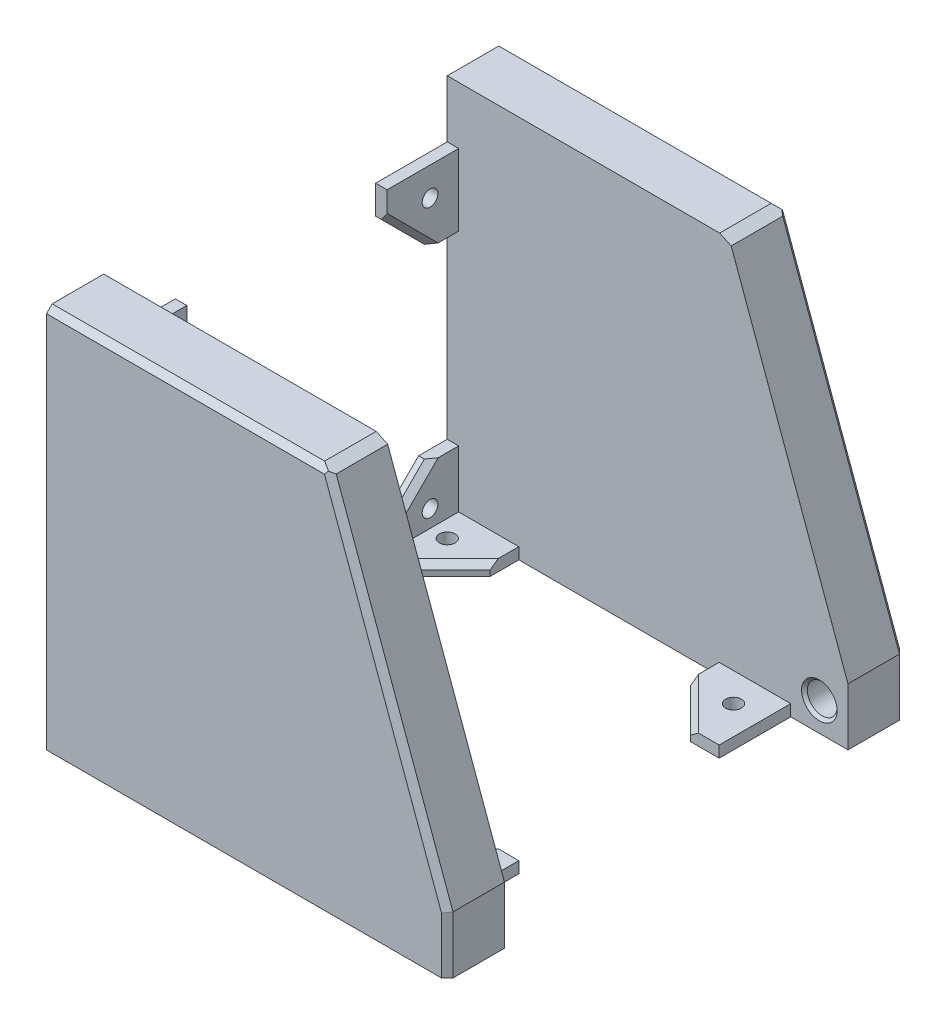
from build123d import *

# Parameters (mm, degrees)
BOSS_EXTRUDE1_DEPTH     = 80
CUT_EXTRUDE3_REACH      = 125.053
SKETCH2_W               = 60
SKETCH2_H               = 56.984631039
SKETCH2_H_2             = 10
CUT_EXTRUDE4_DEPTH      = 65
CUT_EXTRUDE4_DEPTH_BACK = 5
SKETCH4_R               = 2.6
SKETCH6_W               = 12.5
SKETCH6_H               = 12.5
BOSS_EXTRUDE2_DEPTH     = 2
CHAMFER1_SIZE           = 7.5
CHAMFER2_SIZE           = 7.5
SKETCH7_R               = 1.375
CUT_EXTRUDE5_DEPTH      = 2
CHAMFER3_SIZE           = 1
CHAMFER4_SIZE           = 1
CHAMFER5_SIZE           = 1
CHAMFER6_SIZE           = 1
CHAMFER7_SIZE           = 0.5
CHAMFER8_SIZE           = 0.5
CHAMFER9_SIZE           = 1
CHAMFER9_SIZE2          = 1.673157185
CHAMFER10_SIZE          = 1
CHAMFER10_SIZE2         = 1.673157185
SKETCH9_W               = 2
SKETCH9_H               = 12.5
BOSS_EXTRUDE3_DEPTH     = 10
CHAMFER11_SIZE          = 7.5
CHAMFER12_SIZE          = 7.5
CHAMFER13_SIZE          = 1
CHAMFER14_SIZE          = 1
SKETCH11_W              = 2
SKETCH11_H              = 12.5
BOSS_EXTRUDE4_DEPTH     = 12.5
SKETCH12_W              = 2
SKETCH12_H              = 12.5
BOSS_EXTRUDE5_DEPTH     = 12.5
CHAMFER15_SIZE          = 7.5
CHAMFER16_SIZE          = 7.5
CHAMFER17_SIZE          = 1
CHAMFER18_SIZE          = 1
SKETCH10_R              = 1.375
CUT_EXTRUDE6_DEPTH      = 2


with BuildPart() as part:
    # Sketch1 → Boss-Extrude1 (new body)
    with BuildSketch(Plane.XY):
        Polygon((-64.999999996, -5), (5, -5), (5, 5), (-15.740709509, 61.984631039), (-64.999999996, 61.984631039), align=None)
    extrude(amount=BOSS_EXTRUDE1_DEPTH)

    # Cut-Extrude3: up to this face of the body (flat: up to its plane)
    cut_extrude3_end = Plane(part.part.faces().sort_by_distance((-64.999999996, 28.49231552, 40))[0])
    # Sketch2 → Cut-Extrude3 (cut, up to the picked face)
    with BuildSketch(Plane(origin=(5, 0, 0), x_dir=(0, 0, -1), z_dir=(1, 0, 0)), mode=Mode.PRIVATE) as cut_extrude3_sk1:
        with Locations((-40, 33.49231552)):
            Rectangle(SKETCH2_W, SKETCH2_H)
    cut_extrude3_tool1 = split(extrude(cut_extrude3_sk1.sketch, amount=-CUT_EXTRUDE3_REACH, mode=Mode.PRIVATE), bisect_by=cut_extrude3_end, keep=Keep.BOTH, mode=Mode.PRIVATE)
    # Sketch2 → Cut-Extrude3 (cut, up to the picked face)
    with BuildSketch(Plane(origin=(5, 0, 0), x_dir=(0, 0, -1), z_dir=(1, 0, 0)), mode=Mode.PRIVATE) as cut_extrude3_sk2:
        with Locations((-40, 0)):
            Rectangle(SKETCH2_W, SKETCH2_H_2)
    cut_extrude3_tool2 = split(extrude(cut_extrude3_sk2.sketch, amount=-CUT_EXTRUDE3_REACH, mode=Mode.PRIVATE), bisect_by=cut_extrude3_end, keep=Keep.BOTH, mode=Mode.PRIVATE)
    add(cut_extrude3_tool1.solids().sort_by(Axis((5, 33.492316, 40), (-1, 0, 0)))[0], mode=Mode.SUBTRACT)
    add(cut_extrude3_tool2.solids().sort_by(Axis((5, 0, 40), (-1, 0, 0)))[0], mode=Mode.SUBTRACT)


with BuildPart() as cut_extrude3_piece_1:
    # of the separate pieces the step leaves, piece 1, a body of its own (cut_extrude3_pieces)
    add(part.part.solids().sort_by_distance((-15.740709509, 61.984631039, 0))[0])


with BuildPart() as cut_extrude3_piece_2:
    # of the separate pieces the step leaves, piece 2, a body of its own (cut_extrude3_pieces)
    add(part.part.solids().sort_by_distance((-15.740709509, 61.984631039, 70))[0])


with BuildPart() as cut_extrude4_tool:
    # Sketch4 → Cut-Extrude4 (new, two sides: drawn at the far end of the back side and taken through both)
    with BuildSketch(Plane.XY.offset(10).offset(-CUT_EXTRUDE4_DEPTH_BACK)):
        with Locations(Location((0, 0, 0), (0, 0, 180))):
            Circle(SKETCH4_R)
    extrude(amount=CUT_EXTRUDE4_DEPTH + CUT_EXTRUDE4_DEPTH_BACK)


with BuildPart() as cut_extrude3_piece_1_1:
    add(cut_extrude3_piece_1.part)

    # Cut-Extrude4: cut by cut_extrude4_tool
    add(cut_extrude4_tool.part, mode=Mode.SUBTRACT)



with BuildPart() as cut_extrude3_piece_2_1:
    add(cut_extrude3_piece_2.part)

    # Cut-Extrude4: cut by cut_extrude4_tool
    add(cut_extrude4_tool.part, mode=Mode.SUBTRACT)


with BuildPart() as cut_extrude3_piece_1_2:
    add(cut_extrude3_piece_1_1.part)

    add(cut_extrude3_piece_2_1.part)  # Boss-Extrude2 merges Cut-Extrude3 piece 2
    # Sketch6 → Boss-Extrude2 (add)
    with BuildSketch(Plane.XZ.offset(5)):
        with Locations((-11.249999996, 63.75)):
            Rectangle(SKETCH6_W, SKETCH6_H)
        with Locations((-58.749999996, 63.75)):
            Rectangle(SKETCH6_W, SKETCH6_H)
        with Locations((-58.749999996, 16.25)):
            Rectangle(SKETCH6_W, SKETCH6_H)
        with Locations((-11.249999996, 16.25)):
            Rectangle(SKETCH6_W, SKETCH6_H)
    extrude(amount=-BOSS_EXTRUDE2_DEPTH)

    # Chamfer1
    chamfer1_edges = [cut_extrude3_piece_1_2.edges().sort_by_distance(p)[0] for p in [
        (-52.499999996, -4, 22.5),
        (-17.499999996, -4, 22.5),
    ]]
    chamfer(chamfer1_edges, length=CHAMFER1_SIZE)

    # Chamfer2
    chamfer2_edges = [cut_extrude3_piece_1_2.edges().sort_by_distance(p)[0] for p in [
        (-17.499999996, -4, 57.5),
        (-52.499999996, -4, 57.5),
    ]]
    chamfer(chamfer2_edges, length=CHAMFER2_SIZE)

    # Sketch7 → Cut-Extrude5 (cut)
    with BuildSketch(Plane(origin=(0, -3, 0), x_dir=(1, 0, 0), z_dir=(0, 1, 0))):
        with Locations(Location((-59.999999996, -15, 0), (0, 0, 270))):
            Circle(SKETCH7_R)
        with Locations(Location((-9.999999996, -15, 0), (0, 0, 270))):
            Circle(SKETCH7_R)
        with Locations(Location((-9.999999996, -65, 0), (0, 0, 270))):
            Circle(SKETCH7_R)
        with Locations(Location((-59.999999996, -65, 0), (0, 0, 270))):
            Circle(SKETCH7_R)
    extrude(amount=-CUT_EXTRUDE5_DEPTH, mode=Mode.SUBTRACT)

    # Chamfer3
    chamfer3_edges = [cut_extrude3_piece_1_2.edges().sort_by_distance(p)[0] for p in [
        (-40.370354753, 61.984631039, 0),
        (5, 0, 0),
        (-5.370354754, 33.49231552, 0),
    ]]
    chamfer(chamfer3_edges, length=CHAMFER3_SIZE)

    # Chamfer4
    chamfer4_edges = [cut_extrude3_piece_1_2.edges().sort_by_distance(p)[0] for p in [
        (5, 0, 80),
        (-5.370354754, 33.49231552, 80),
        (-40.370354753, 61.984631039, 80),
    ]]
    chamfer(chamfer4_edges, length=CHAMFER4_SIZE)

    # Chamfer5
    chamfer5_edges = [cut_extrude3_piece_1_2.edges().sort_by_distance(p)[0] for p in [
        (-13.749999996, -3, 61.25),
        (-56.249999996, -3, 61.25),
    ]]
    chamfer(chamfer5_edges, length=CHAMFER5_SIZE)

    # Chamfer6
    chamfer6_edges = [cut_extrude3_piece_1_2.edges().sort_by_distance(p)[0] for p in [
        (-13.749999996, -3, 18.75),
        (-56.249999996, -3, 18.75),
    ]]
    chamfer(chamfer6_edges, length=CHAMFER6_SIZE)

    # Chamfer7
    chamfer7_edges = [cut_extrude3_piece_1_2.edges().sort_by_distance(p)[0] for p in [
        (2.6, 0, 70),
    ]]
    chamfer(chamfer7_edges, length=CHAMFER7_SIZE)

    # Chamfer8
    chamfer8_edges = [cut_extrude3_piece_1_2.edges().sort_by_distance(p)[0] for p in [
        (2.6, 0, 10),
    ]]
    chamfer(chamfer8_edges, length=CHAMFER8_SIZE)

    # Chamfer9
    chamfer9_edges = [cut_extrude3_piece_1_2.edges().sort_by_distance(p)[0] for p in [
        (-15.740709509, 61.984631039, 74.5),
    ]]
    chamfer9_side = [cut_extrude3_piece_1_2.faces().sort_by_distance(p)[0] for p in [
        (-5.370354754, 33.49231552, 74.5),
    ]]
    chamfer(chamfer9_edges, length=CHAMFER9_SIZE, length2=CHAMFER9_SIZE2, reference=chamfer9_side[0])

    # Chamfer10
    chamfer10_edges = [cut_extrude3_piece_1_2.edges().sort_by_distance(p)[0] for p in [
        (-15.740709509, 61.984631039, 5.5),
    ]]
    chamfer10_side = [cut_extrude3_piece_1_2.faces().sort_by_distance(p)[0] for p in [
        (-5.370354754, 33.49231552, 5.5),
    ]]
    chamfer(chamfer10_edges, length=CHAMFER10_SIZE, length2=CHAMFER10_SIZE2, reference=chamfer10_side[0])

    # Sketch9 → Boss-Extrude3 (add)
    with BuildSketch(Plane(origin=(0, -3, 0), x_dir=(1, 0, 0), z_dir=(0, 1, 0))):
        with Locations((-63.999999996, -16.25)):
            Rectangle(SKETCH9_W, SKETCH9_H)
        with Locations((-63.999999996, -63.75)):
            Rectangle(SKETCH9_W, SKETCH9_H)
    extrude(amount=BOSS_EXTRUDE3_DEPTH)

    # Chamfer11
    chamfer11_edges = [cut_extrude3_piece_1_2.edges().sort_by_distance(p)[0] for p in [
        (-63.999999996, 7, 22.5),
    ]]
    chamfer(chamfer11_edges, length=CHAMFER11_SIZE)

    # Chamfer12
    chamfer12_edges = [cut_extrude3_piece_1_2.edges().sort_by_distance(p)[0] for p in [
        (-63.999999996, 7, 57.5),
    ]]
    chamfer(chamfer12_edges, length=CHAMFER12_SIZE)

    # Chamfer13
    chamfer13_edges = [cut_extrude3_piece_1_2.edges().sort_by_distance(p)[0] for p in [
        (-62.999999996, 3.25, 18.75),
    ]]
    chamfer(chamfer13_edges, length=CHAMFER13_SIZE)

    # Chamfer14
    chamfer14_edges = [cut_extrude3_piece_1_2.edges().sort_by_distance(p)[0] for p in [
        (-62.999999996, 3.25, 61.25),
    ]]
    chamfer(chamfer14_edges, length=CHAMFER14_SIZE)

    # Sketch11 → Boss-Extrude4 (add)
    with BuildSketch(Plane(origin=(0, 0, 70), x_dir=(-1, 0, 0), z_dir=(0, 0, -1))):
        with Locations((63.999999996, 45.734631039)):
            Rectangle(SKETCH11_W, SKETCH11_H)
    extrude(amount=BOSS_EXTRUDE4_DEPTH)

    # Sketch12 → Boss-Extrude5 (add)
    with BuildSketch(Plane.XY.offset(10)):
        with Locations((-63.999999996, 45.734631039)):
            Rectangle(SKETCH12_W, SKETCH12_H)
    extrude(amount=BOSS_EXTRUDE5_DEPTH)

    # Chamfer15
    chamfer15_edges = [cut_extrude3_piece_1_2.edges().sort_by_distance(p)[0] for p in [
        (-63.999999996, 39.484631039, 22.5),
    ]]
    chamfer(chamfer15_edges, length=CHAMFER15_SIZE)

    # Chamfer16
    chamfer16_edges = [cut_extrude3_piece_1_2.edges().sort_by_distance(p)[0] for p in [
        (-63.999999996, 39.484631039, 57.5),
    ]]
    chamfer(chamfer16_edges, length=CHAMFER16_SIZE)

    # Chamfer17
    chamfer17_edges = [cut_extrude3_piece_1_2.edges().sort_by_distance(p)[0] for p in [
        (-62.999999996, 43.234631039, 61.25),
    ]]
    chamfer(chamfer17_edges, length=CHAMFER17_SIZE)

    # Chamfer18
    chamfer18_edges = [cut_extrude3_piece_1_2.edges().sort_by_distance(p)[0] for p in [
        (-62.999999996, 43.234631039, 18.75),
    ]]
    chamfer(chamfer18_edges, length=CHAMFER18_SIZE)

    # Sketch10 → Cut-Extrude6 (cut)
    with BuildSketch(Plane(origin=(-62.999999996, 0, 0), x_dir=(0, 0, -1), z_dir=(1, 0, 0))):
        with Locations((-65, 0)):
            Circle(SKETCH10_R)
        with Locations((-15, 0)):
            Circle(SKETCH10_R)
        with Locations((-65, 46.984631039)):
            Circle(SKETCH10_R)
        with Locations((-15, 46.984631039)):
            Circle(SKETCH10_R)
    extrude(amount=-CUT_EXTRUDE6_DEPTH, mode=Mode.SUBTRACT)


solid = cut_extrude3_piece_1_2.part
